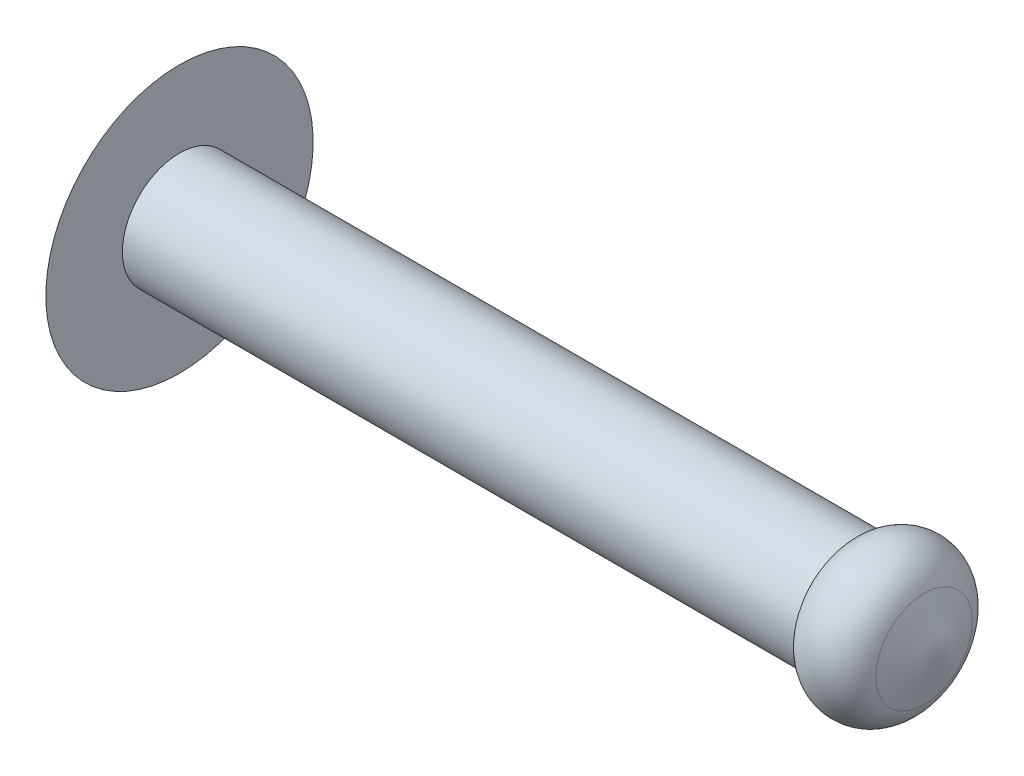
from build123d import *


with BuildPart() as part:
    # Croquis1 → Revolución1 (revolve)
    with BuildSketch(Plane.XY):
        with BuildLine():
            Line((15, 0), (14.35, 1.9))
            ThreePointArc((14.35, 1.9), (13.034591481, 2.967387775), (11.5, 2.25))
            Line((11.5, 2.25), (-15, 2.25))
            Line((-15, 2.25), (-15, 5.267826876))
            ThreePointArc((-15, 5.267826876), (-16.117692031, 2.738612788), (-16.5, 0))
            Line((-16.5, 0), (15, 0))
        make_face()
    revolve(axis=Axis((15, 0, 0), (-1, 0, 0)))


solid = part.part
